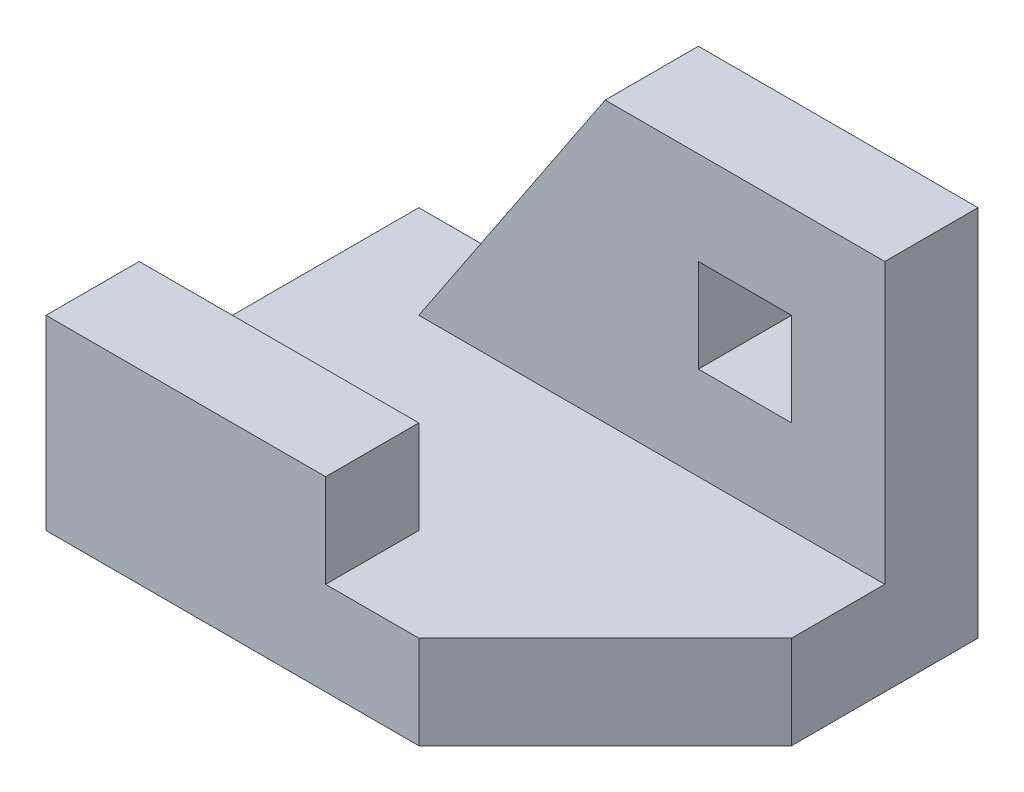
from build123d import *

# Parameters (mm, degrees)
SKETCH_1_W      = 20
SKETCH_1_H      = 20
SKETCH_1_W_2    = 10
SKETCH_1_H_2    = 10
EXTRUDE_1_DEPTH = 5
SKETCH_2_W      = 5
SKETCH_2_H      = 5
EXTRUDE_2_DEPTH = 5
SKETCH_3_W      = 15
SKETCH_3_H      = 5
EXTRUDE_3_DEPTH = 5


with BuildPart() as part:
    # 草圖1 → 填料-伸長1 (new body)
    with BuildSketch(Plane(origin=(0, 0, 0), x_dir=(1, 0, 0), z_dir=(0, 1, 0))):
        with Locations((10, 10)):
            Rectangle(SKETCH_1_W, SKETCH_1_H)
        Polygon((20, 0), (30, 10), (20, 10), align=None)
        with Locations((25, 15)):
            Rectangle(SKETCH_1_W_2, SKETCH_1_H_2)
    extrude(amount=EXTRUDE_1_DEPTH)

    # 草圖2 → 填料-伸長2 (add)
    with BuildSketch(Plane(origin=(0, 0, -20), x_dir=(-1, 0, 0), z_dir=(0, 0, -1))):
        Polygon((-30, 5), (-30, 20), (-15, 20), (-5, 5), align=None)
        with Locations((-22.5, 12.5)):
            Rectangle(SKETCH_2_W, SKETCH_2_H, mode=Mode.SUBTRACT)
    extrude(amount=-EXTRUDE_2_DEPTH)

    # 草圖3 → 填料-伸長3 (add)
    with BuildSketch(Plane(origin=(0, 5, 0), x_dir=(1, 0, 0), z_dir=(0, 1, 0))):
        with Locations((7.5, 2.5)):
            Rectangle(SKETCH_3_W, SKETCH_3_H)
    extrude(amount=EXTRUDE_3_DEPTH)


solid = part.part
